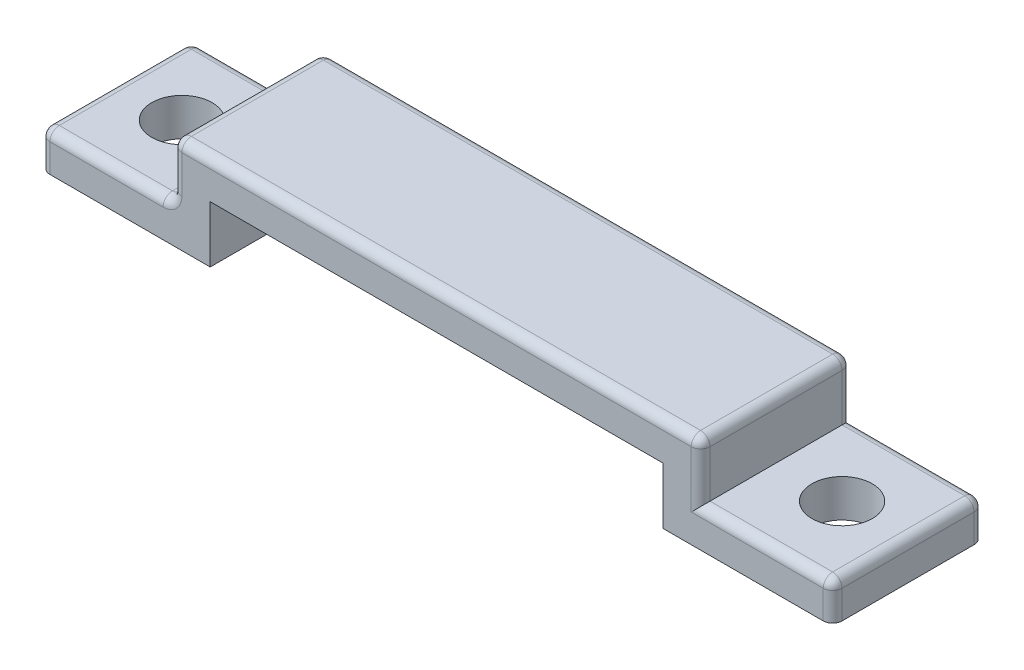
from build123d import *

# Parameters (mm, degrees)
GRUNDK_RPER_DEPTH         = 8
SKIZZE2_R                 = 1.6
BOHRUNG_BEFESTIGUNG_DEPTH = 23.671568098
VERRUNDUNG1_R             = 0.5


with BuildPart() as part:
    # Skizze1 → Grundkörper (new body)
    with BuildSketch(Plane.XY):
        Polygon((-21, 0), (-12, 0), (-12, 3), (12, 3), (12, 0), (21, 0), (21, 2), (14, 2), (14, 5), (-14, 5), (-14, 2), (-21, 2), align=None)
    extrude(amount=GRUNDK_RPER_DEPTH)

    # Skizze2 → Bohrung_Befestigung (cut, through all)
    with BuildSketch(Plane(origin=(0, 2, 0), x_dir=(1, 0, 0), z_dir=(0, 1, 0))):
        with Locations(Location((-17.5, -4, 0), (0, 0, 180))):
            Circle(SKIZZE2_R)
        with Locations((17.5, -4)):
            Circle(SKIZZE2_R)
    extrude(amount=-BOHRUNG_BEFESTIGUNG_DEPTH, mode=Mode.SUBTRACT)

    # Verrundung1
    verrundung1_edges = [part.edges().sort_by_distance(p)[0] for p in [
        (-17.5, 2, 0),
        (-14, 3.5, 0),
        (0, 5, 0),
        (14, 3.5, 0),
        (17.5, 2, 0),
        (21, 1, 0),
        (-21, 1, 0),
        (-21, 2, 4),
        (-14, 2, 4),
        (-14, 5, 4),
        (14, 5, 4),
        (21, 2, 4),
        (21, 1, 8),
        (17.5, 2, 8),
        (14, 3.5, 8),
        (0, 5, 8),
        (-14, 3.5, 8),
        (-17.5, 2, 8),
        (-21, 1, 8),
    ]]
    fillet(verrundung1_edges, radius=VERRUNDUNG1_R)


solid = part.part
